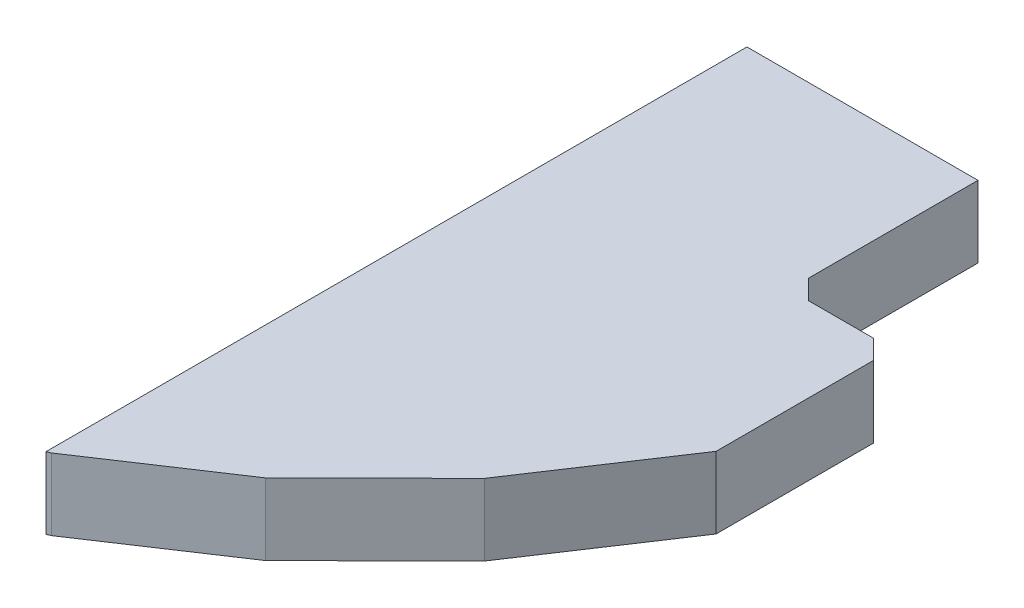
from build123d import *

# Parameters (mm, degrees)
BOSS_EXTRUDE1_DEPTH = 7.409200066


with BuildPart() as part:
    # Sketch1 → Boss-Extrude1 (new body)
    with BuildSketch(Plane(origin=(0, 0, 0), x_dir=(1, 0, 0), z_dir=(0, 1, 0))):
        Polygon((0, 0), (23.9, 0), (23.9, -17.55), (25.9, -19.55), (32.63, -19.55), (34.63, -21.55), (34.63, -37.822775182), (25.071721684, -52.231292825), (13.716603187, -63.5034392), (0.388693134, -72.355942441), (0, -72.516110123), align=None)
    extrude(amount=BOSS_EXTRUDE1_DEPTH)


solid = part.part
